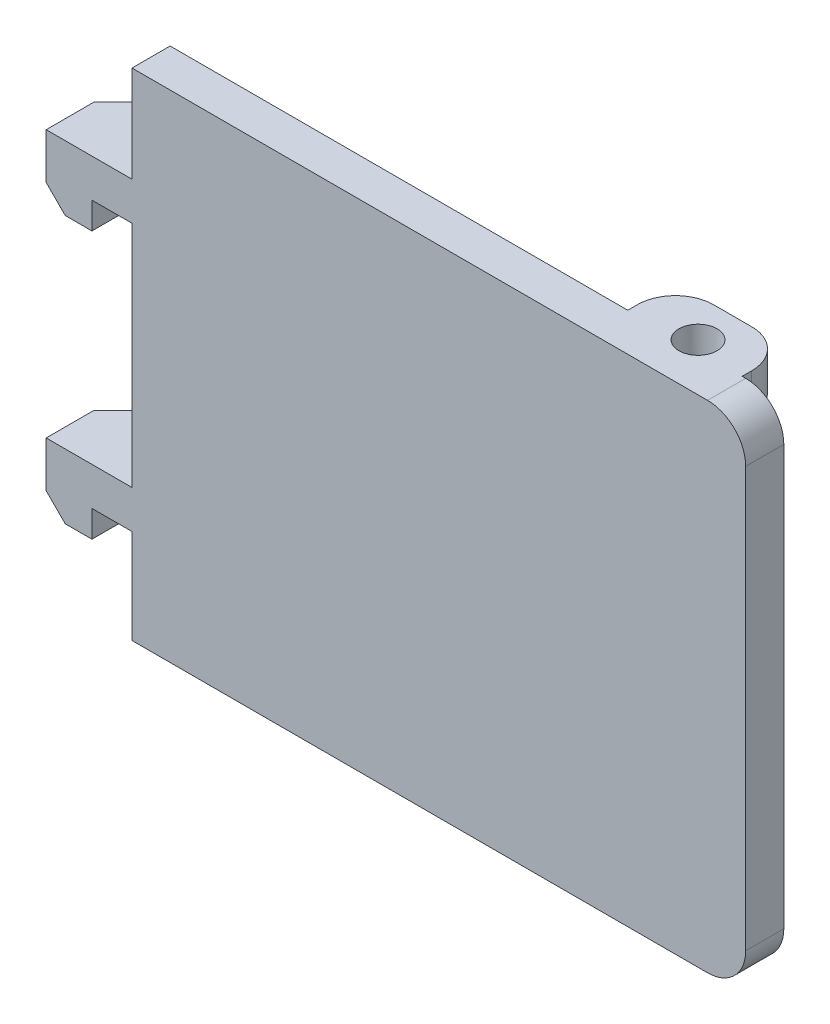
from build123d import *

# Parameters (mm, degrees)
SKETCH_2_W          = 32.183544672
SKETCH_2_H          = 26
EXTRUDE_1_DEPTH     = 2
FILLET_1_R          = 2
SKETCH_5_W          = 6
SKETCH_5_H          = 2
EXTRUDE_2_DEPTH     = 2.5
FILLET_2_R          = 2
SKETCH_6_R          = 1
CUT_EXTRUDE_3_DEPTH = 4
CUT_EXTRUDE_3_DRAFT = -2
SKETCH_7_R          = 1
CUT_EXTRUDE_4_DEPTH = 4
CUT_EXTRUDE_4_DRAFT = -2
SKETCH_8_W          = 4.5
SKETCH_8_H          = 2
EXTRUDE_3_DEPTH     = 2
SKETCH_10_W         = 2.4
SKETCH_10_H         = 1.4
EXTRUDE_4_DEPTH     = 2
EXTRUDE_4_2_DEPTH   = 2
SKETCH_11_W         = 8.5
SKETCH_11_H         = 2
EXTRUDE_5_DEPTH     = 2.5
CHAMFER_1_SIZE      = 2
CHAMFER_2_SIZE      = 1


with BuildPart() as part:
    # 草图2 → 凸台-拉伸1 (new body)
    with BuildSketch(Plane.XY):
        with Locations((-0.901029093, -19.434236018)):
            Rectangle(SKETCH_2_W, SKETCH_2_H)
    extrude(amount=EXTRUDE_1_DEPTH)

    # 圆角1
    fillet_1_edges = [part.edges().sort_by_distance(p)[0] for p in [
        (15.190743243, -32.434236018, 1),
        (15.190743243, -6.434236018, 1),
    ]]
    fillet(fillet_1_edges, radius=FILLET_1_R)

    # 草图5 → 凸台-拉伸2 (add)
    with BuildSketch(Plane(origin=(0, 0, 0), x_dir=(-1, 0, 0), z_dir=(0, 0, -1))):
        with Locations((-10.007198571, -7.434236018)):
            Rectangle(SKETCH_5_W, SKETCH_5_H)
        with Locations((-10.007198571, -31.434236018)):
            Rectangle(SKETCH_5_W, SKETCH_5_H)
    extrude(amount=EXTRUDE_2_DEPTH)

    # 圆角2
    fillet_2_edges = [part.edges().sort_by_distance(p)[0] for p in [
        (13.007198571, -7.434236018, -2.5),
        (7.007198571, -7.434236018, -2.5),
        (13.007198571, -31.434236018, -2.5),
        (7.007198571, -31.434236018, -2.5),
    ]]
    fillet(fillet_2_edges, radius=FILLET_2_R)


with BuildPart() as cut_extrude_3_tool:
    # 草图6 → 切除-拉伸3 (with draft: the straight prism first)
    with BuildSketch(Plane.XZ.offset(32.434236018)):
        with Locations((10.190743244, -0.5)):
            Circle(SKETCH_6_R)
    extrude(amount=-CUT_EXTRUDE_3_DEPTH)
    # 切除-拉伸3: the draft: its side faces are tilted about the plane it starts from
    cut_extrude_3_sides = [cut_extrude_3_tool.faces().sort_by_distance(p)[0] for p in [
        (9.190743243, -30.434236018, -0.5),
    ]]
    draft(cut_extrude_3_sides, Plane.XZ.offset(32.434236018), CUT_EXTRUDE_3_DRAFT)


with BuildPart() as part_1:
    add(part.part)

    # 切除-拉伸3: cut by cut_extrude_3_tool
    add(cut_extrude_3_tool.part, mode=Mode.SUBTRACT)


with BuildPart() as cut_extrude_4_tool:
    # 草图7 → 切除-拉伸4 (with draft: the straight prism first)
    with BuildSketch(Plane(origin=(0, -6.434236018, 0), x_dir=(1, 0, 0), z_dir=(0, 1, 0))):
        with Locations((10.190743243, 0.5)):
            Circle(SKETCH_7_R)
    extrude(amount=-CUT_EXTRUDE_4_DEPTH)
    # 切除-拉伸4: the draft: its side faces are tilted about the plane it starts from
    cut_extrude_4_sides = [cut_extrude_4_tool.faces().sort_by_distance(p)[0] for p in [
        (9.190743243, -8.434236018, -0.5),
    ]]
    draft(cut_extrude_4_sides, Plane(origin=(0, -6.434236018, 0), x_dir=(1, 0, 0), z_dir=(0, 1, 0)), CUT_EXTRUDE_4_DRAFT)


with BuildPart() as part_2:
    add(part_1.part)

    # 切除-拉伸4: cut by cut_extrude_4_tool
    add(cut_extrude_4_tool.part, mode=Mode.SUBTRACT)

    # 草图8 → 凸台-拉伸3 (add)
    with BuildSketch(Plane(origin=(0, 0, 0), x_dir=(-1, 0, 0), z_dir=(0, 0, -1))):
        with Locations((19.242801429, -12.484236018)):
            Rectangle(SKETCH_8_W, SKETCH_8_H)
        with Locations((19.242801429, -26.484236018)):
            Rectangle(SKETCH_8_W, SKETCH_8_H)
    extrude(amount=-EXTRUDE_3_DEPTH)



with BuildPart() as body_2:
    # 草图10 → 凸台-拉伸4 (new body)
    with BuildSketch(Plane(origin=(0, 0, 0), x_dir=(-1, 0, 0), z_dir=(0, 0, -1))):
        with Locations((20.292801429, -14.184236018)):
            Rectangle(SKETCH_10_W, SKETCH_10_H)
    extrude(amount=-EXTRUDE_4_DEPTH)


with BuildPart() as body_3:
    # 草图10 → Extrude 4 2 (new body)
    with BuildSketch(Plane(origin=(0, 0, 0), x_dir=(-1, 0, 0), z_dir=(0, 0, -1))):
        with Locations((20.292801429, -28.184236018)):
            Rectangle(SKETCH_10_W, SKETCH_10_H)
    extrude(amount=-EXTRUDE_4_2_DEPTH)


with BuildPart() as part_3:
    add(part_2.part)

    add(body_2.part)  # 凸台-拉伸5 merges body 2

    add(body_3.part)  # 凸台-拉伸5 merges body 3
    # 草图11 → 凸台-拉伸5 (add)
    with BuildSketch(Plane(origin=(0, 0, 0), x_dir=(-1, 0, 0), z_dir=(0, 0, -1))):
        with Locations((17.242801429, -12.484236018)):
            Rectangle(SKETCH_11_W, SKETCH_11_H)
        with Locations((17.242801429, -26.484236018)):
            Rectangle(SKETCH_11_W, SKETCH_11_H)
    extrude(amount=EXTRUDE_5_DEPTH)

    # 倒角1
    chamfer_1_edges = [part_3.edges().sort_by_distance(p)[0] for p in [
        (-21.492801429, -12.484236018, -2.5),
        (-12.992801429, -12.484236018, -2.5),
        (-21.492801429, -26.484236018, -2.5),
        (-12.992801429, -26.484236018, -2.5),
    ]]
    chamfer(chamfer_1_edges, length=CHAMFER_1_SIZE)

    # 倒角2
    chamfer_2_edges = [part_3.edges().sort_by_distance(p)[0] for p in [
        (-21.492801429, -14.884236018, 1),
        (-21.492801429, -28.884236018, 1),
    ]]
    chamfer(chamfer_2_edges, length=CHAMFER_2_SIZE)


solid = part_3.part
